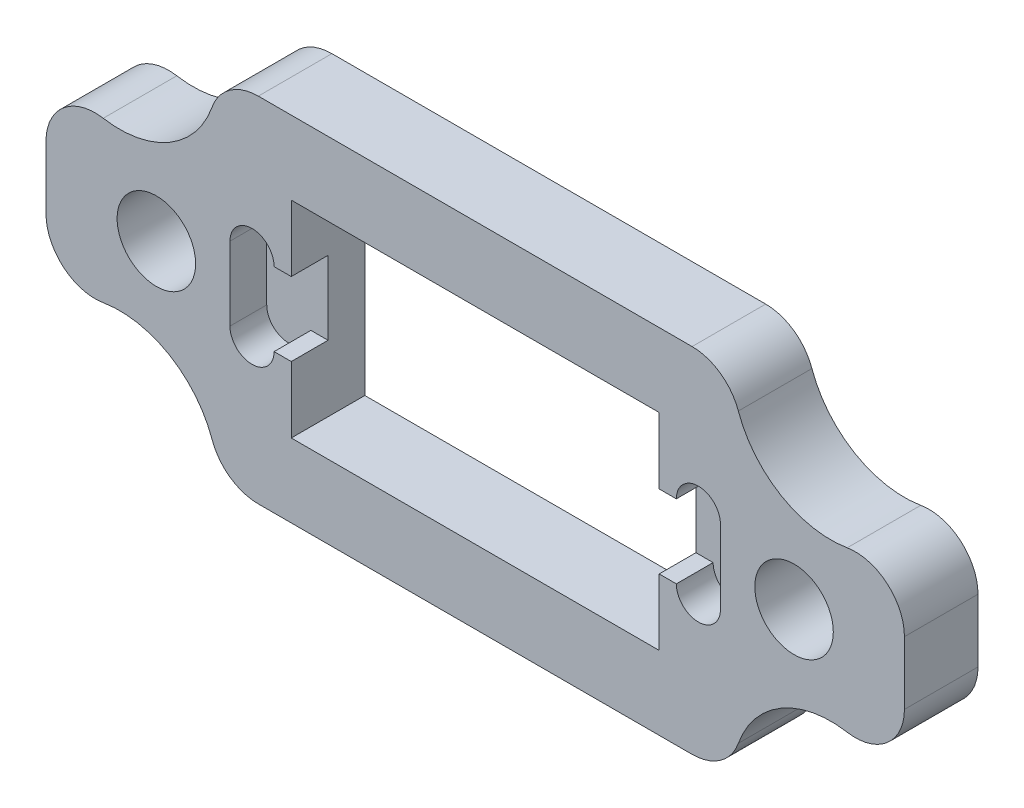
from build123d import *

# Parameters (mm, degrees)
SKETCH_1_W          = 35
SKETCH_1_H          = 14.4
SKETCH_1_W_2        = 15
SKETCH_1_H_2        = 8.4
EXTRUDE_1_DEPTH     = 3
SKETCH_2_W          = 20
SKETCH_2_H          = 3
CUT_EXTRUDE_1_DEPTH = 1.5
SKETCH_3_R          = 1.6
CUT_EXTRUDE_2_DEPTH = 20
SKETCH_5_R          = 4
CUT_EXTRUDE_4_DEPTH = 10
FILLET_2_R          = 2
SKETCH_6_R          = 0.9
CUT_EXTRUDE_5_DEPTH = 1.5


with BuildPart() as part:
    # 草图1 → 凸台-拉伸1 (new body)
    with BuildSketch(Plane.XY):
        Rectangle(SKETCH_1_W, SKETCH_1_H)
        Rectangle(SKETCH_1_W_2, SKETCH_1_H_2, mode=Mode.SUBTRACT)
    extrude(amount=EXTRUDE_1_DEPTH)

    # 草图2 → 切除-拉伸1 (cut)
    with BuildSketch(Plane.XY.offset(3)):
        Rectangle(SKETCH_2_W, SKETCH_2_H)
    extrude(amount=-CUT_EXTRUDE_1_DEPTH, mode=Mode.SUBTRACT)

    # 草图3 → 切除-拉伸2 (cut)
    with BuildSketch(Plane.XY.offset(3)):
        with Locations((-13, 0)):
            Circle(SKETCH_3_R)
        with Locations((13, 0)):
            Circle(SKETCH_3_R)
    extrude(amount=-CUT_EXTRUDE_2_DEPTH, mode=Mode.SUBTRACT)

    # 草图5 → 切除-拉伸4 (cut)
    with BuildSketch(Plane.XY.offset(3)):
        with Locations((-14.5, 7.2)):
            Circle(SKETCH_5_R)
        with Locations((14.5, 7.2)):
            Circle(SKETCH_5_R)
        with Locations((14.5, -7.2)):
            Circle(SKETCH_5_R)
        with Locations((-14.5, -7.2)):
            Circle(SKETCH_5_R)
    extrude(amount=-CUT_EXTRUDE_4_DEPTH, mode=Mode.SUBTRACT)

    # 圆角2
    fillet_2_edges = [part.edges().sort_by_distance(p)[0] for p in [
        (10.5, -7.2, 1.5),
        (-10.5, -7.2, 1.5),
        (-17.5, 4.554248689, 1.5),
        (10.5, 7.2, 1.5),
        (-17.5, -4.554248689, 1.5),
        (17.5, -4.554248689, 1.5),
        (17.5, 4.554248689, 1.5),
        (-10.5, 7.2, 1.5),
    ]]
    fillet(fillet_2_edges, radius=FILLET_2_R)

    # 草图6 → 切除-拉伸5 (cut)
    with BuildSketch(Plane.XY.offset(3)):
        with Locations((-9.1, 1.5)):
            Circle(SKETCH_6_R)
        with Locations((-9.1, -1.5)):
            Circle(SKETCH_6_R)
        with Locations((9.1, 1.5)):
            Circle(SKETCH_6_R)
        with Locations((9.1, -1.5)):
            Circle(SKETCH_6_R)
    extrude(amount=-CUT_EXTRUDE_5_DEPTH, mode=Mode.SUBTRACT)


solid = part.part
